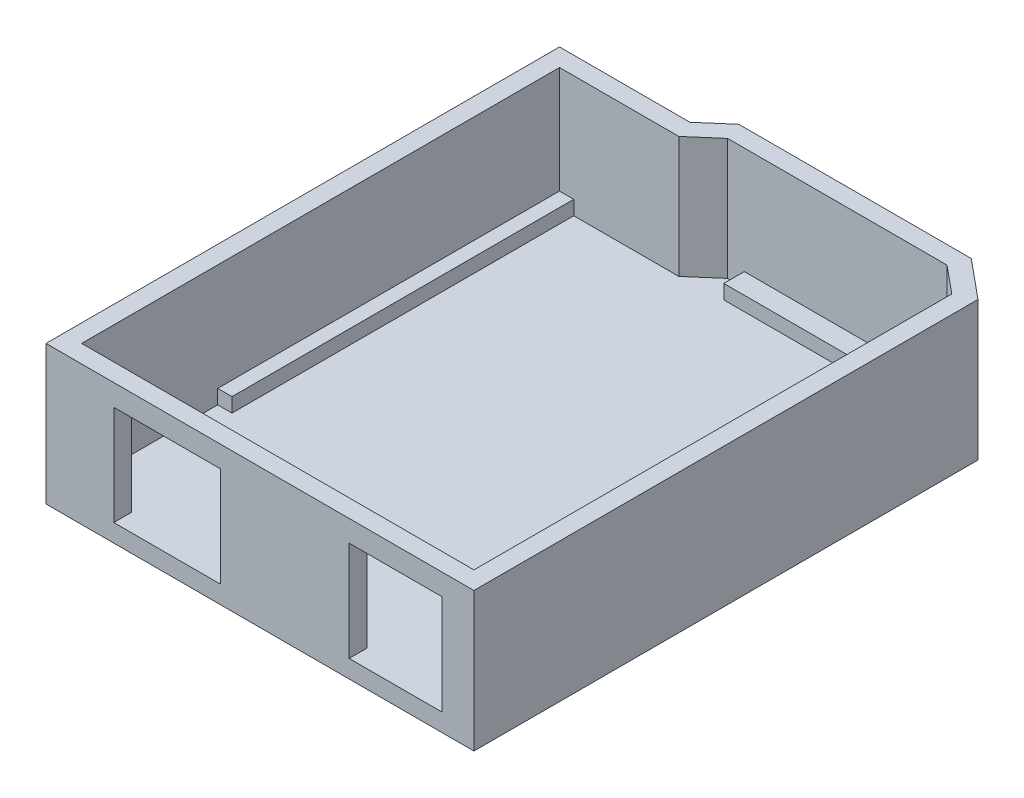
from build123d import *

# Parameters (mm, degrees)
BOSS_EXTRUDE1_DEPTH = 17
SHELL1_T            = 2.5
SKETCH2_W           = 15
SKETCH2_H           = 14
SKETCH2_W_2         = 13
CUT_EXTRUDE1_DEPTH  = 4
SKETCH3_W           = 2
SKETCH3_H           = 50
BOSS_EXTRUDE2_DEPTH = 2
SKETCH4_W           = 26.147040262
SKETCH4_H           = 2.874772828
BOSS_EXTRUDE3_DEPTH = 2


with BuildPart() as part:
    # Sketch1 → Boss-Extrude1 (new body)
    with BuildSketch(Plane(origin=(0, 0, 0), x_dir=(1, 0, 0), z_dir=(0, 1, 0))):
        Polygon((0, 0), (0, 67), (16.729272308, 67), (20.392796314, 70.176839536), (51.157808577, 70.176839536), (55, 67), (55, 0), align=None)
    extrude(amount=BOSS_EXTRUDE1_DEPTH)

    # Shell1
    shell1_openings = [part.faces().sort_by_distance(p)[0] for p in [
        (27.740476626, 17, -34.512318995),
    ]]
    offset(amount=SHELL1_T, openings=shell1_openings, kind=Kind.INTERSECTION)

    # Sketch2 → Cut-Extrude1 (cut)
    with BuildSketch(Plane(origin=(0, 0, 0), x_dir=(-1, 0, 0), z_dir=(0, 0, -1))):
        with Locations((-14.5, 7)):
            Rectangle(SKETCH2_W, SKETCH2_H)
        with Locations((-46.5, 7)):
            Rectangle(SKETCH2_W_2, SKETCH2_H)
    extrude(amount=-CUT_EXTRUDE1_DEPTH, mode=Mode.SUBTRACT)

    # Sketch3 → Boss-Extrude2 (add)
    with BuildSketch(Plane(origin=(0, 0, 0), x_dir=(1, 0, 0), z_dir=(0, 1, 0))):
        with Locations((1, 44.078139118)):
            Rectangle(SKETCH3_W, SKETCH3_H)
        with Locations((54, 44.078139118)):
            Rectangle(SKETCH3_W, SKETCH3_H)
    extrude(amount=BOSS_EXTRUDE2_DEPTH)

    # Sketch4 → Boss-Extrude3 (add)
    with BuildSketch(Plane(origin=(0, 0, 0), x_dir=(1, 0, 0), z_dir=(0, 1, 0))):
        with Locations((35.808300775, 68.739453122)):
            Rectangle(SKETCH4_W, SKETCH4_H)
    extrude(amount=BOSS_EXTRUDE3_DEPTH)


solid = part.part
